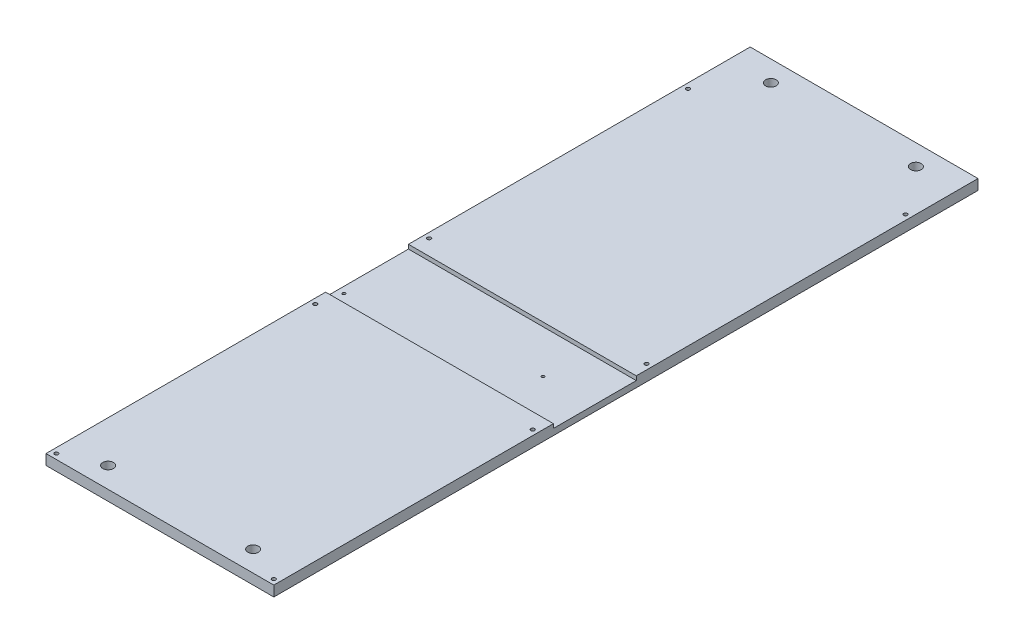
from build123d import *

# Parameters (mm, degrees)
SKETCH1_W           = 139.7
SKETCH1_H           = 431.8
BOSS_EXTRUDE1_DEPTH = 6.35
SKETCH3_R           = 1.1303
CUT_EXTRUDE6_DEPTH  = 6.35
SKETCH4_W           = 139.7
SKETCH4_H           = 50.8
CUT_EXTRUDE7_DEPTH  = 2.54
SKETCH5_R           = 0.889
CUT_EXTRUDE8_DEPTH  = 454.852229365
SKETCH6_R           = 3.2639
CUT_EXTRUDE9_DEPTH  = 454.880658874


with BuildPart() as part:
    # Sketch1 → Boss-Extrude1 (new body)
    with BuildSketch(Plane(origin=(0, 0, 0), x_dir=(1, 0, 0), z_dir=(0, 1, 0))):
        with Locations((69.85, 215.9)):
            Rectangle(SKETCH1_W, SKETCH1_H)
    extrude(amount=BOSS_EXTRUDE1_DEPTH)

    # Sketch3 → Cut-Extrude6 (cut)
    with BuildSketch(Plane(origin=(0, 6.35, 0), x_dir=(1, 0, 0), z_dir=(0, 1, 0))):
        with Locations(Location((3.175, 3.175, 0), (0, 0, 270))):
            Circle(SKETCH3_R)
        with Locations(Location((136.525, 3.175, 0), (0, 0, 270))):
            Circle(SKETCH3_R)
        with Locations(Location((136.525, 161.925, 0), (0, 0, 90))):
            Circle(SKETCH3_R)
        with Locations(Location((136.525, 231.775, 0), (0, 0, 270))):
            Circle(SKETCH3_R)
        with Locations(Location((3.175, 161.925, 0), (0, 0, 270))):
            Circle(SKETCH3_R)
        with Locations(Location((3.175, 231.775, 0), (0, 0, 90))):
            Circle(SKETCH3_R)
        with Locations(Location((3.175, 390.525, 0), (0, 0, 90))):
            Circle(SKETCH3_R)
        with Locations(Location((136.525, 390.525, 0), (0, 0, 270))):
            Circle(SKETCH3_R)
    extrude(amount=-CUT_EXTRUDE6_DEPTH, mode=Mode.SUBTRACT)

    # Sketch4 → Cut-Extrude7 (cut)
    with BuildSketch(Plane(origin=(0, 6.35, 0), x_dir=(1, 0, 0), z_dir=(0, 1, 0))):
        with Locations((69.85, 196.85)):
            Rectangle(SKETCH4_W, SKETCH4_H)
    extrude(amount=-CUT_EXTRUDE7_DEPTH, mode=Mode.SUBTRACT)

    # Sketch5 → Cut-Extrude8 (cut, through all)
    with BuildSketch(Plane(origin=(0, 3.81, 0), x_dir=(1, 0, 0), z_dir=(0, 1, 0))):
        with Locations(Location((3.81, 178.816, 0), (0, 0, 270))):
            Circle(SKETCH5_R)
        with Locations(Location((108.966, 195.834, 0), (0, 0, 270))):
            Circle(SKETCH5_R)
    extrude(amount=-CUT_EXTRUDE8_DEPTH, mode=Mode.SUBTRACT)

    # Sketch6 → Cut-Extrude9 (cut, through all)
    with BuildSketch(Plane(origin=(0, 6.35, 0), x_dir=(1, 0, 0), z_dir=(0, 1, 0))):
        with Locations(Location((25.4, 419.1, 0), (0, 0, 270))):
            Circle(SKETCH6_R)
        with Locations(Location((114.3, 419.1, 0), (0, 0, 90))):
            Circle(SKETCH6_R)
        with Locations(Location((114.3, 12.7, 0), (0, 0, 270))):
            Circle(SKETCH6_R)
        with Locations(Location((25.4, 12.7, 0), (0, 0, 90))):
            Circle(SKETCH6_R)
    extrude(amount=-CUT_EXTRUDE9_DEPTH, mode=Mode.SUBTRACT)


solid = part.part
